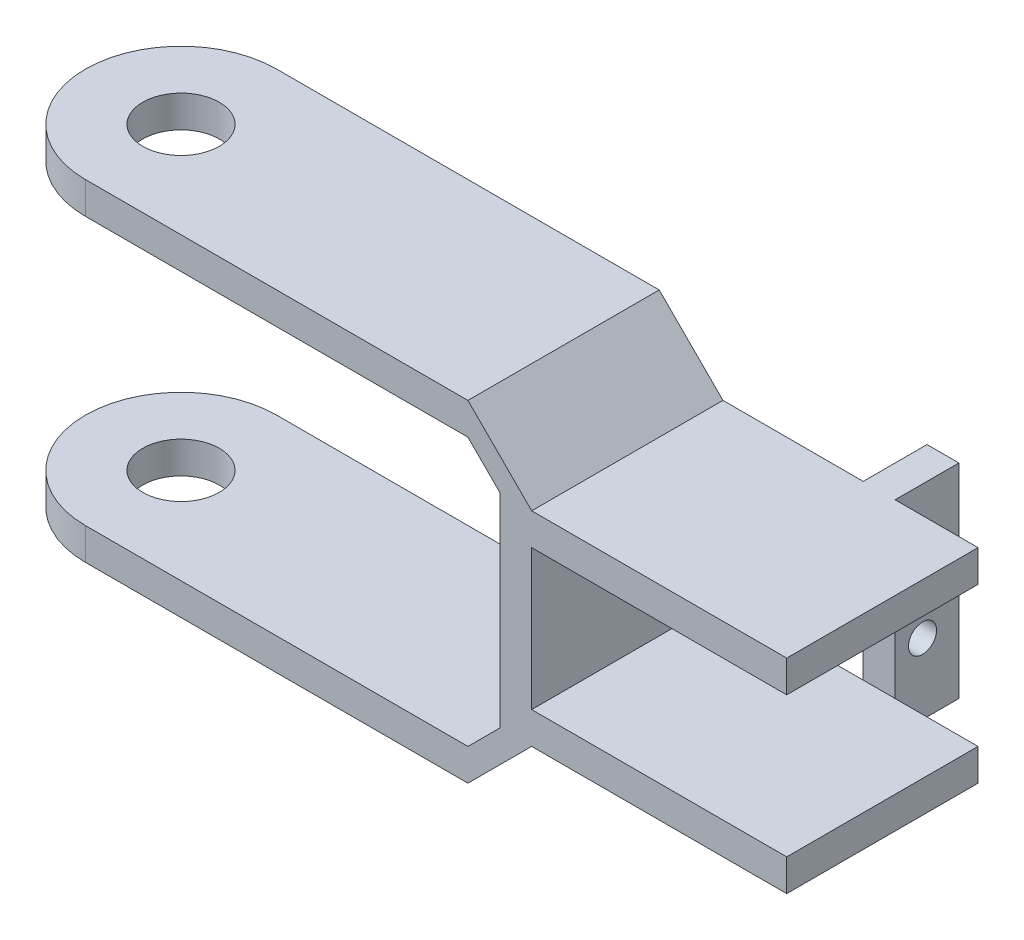
from build123d import *

# Parameters (mm, degrees)
SKETCH1_R           = 6
BOSS_EXTRUDE4_DEPTH = 5
BOSS_EXTRUDE5_DEPTH = 30
BOSS_EXTRUDE6_DEPTH = 30
SKETCH11_R          = 6
BOSS_EXTRUDE7_DEPTH = 5
BOSS_EXTRUDE8_DEPTH = 30
BOSS_EXTRUDE9_DEPTH = 10
CUT_EXTRUDE2_REACH  = 126.008
SKETCH14_R          = 2.2


with BuildPart() as part:
    # Sketch1 → Boss-Extrude4 (new body)
    with BuildSketch(Plane(origin=(0, 0, 0), x_dir=(1, 0, 0), z_dir=(0, 1, 0))):
        with BuildLine():
            Line((0, 15), (60, 15))
            Line((60, 15), (60, -15))
            Line((60, -15), (0, -15))
            ThreePointArc((0, -15), (-15, 0), (0, 15))
        make_face()
        with Locations(Location((0, 0, 0), (0, 0, 270))):
            Circle(SKETCH1_R, mode=Mode.SUBTRACT)
    extrude(amount=BOSS_EXTRUDE4_DEPTH)

    # Sketch8 → Boss-Extrude5 (add)
    with BuildSketch(Plane.XY.offset(15)):
        Polygon((60, 0), (70, -10), (110, -10), (110, -5), (70, -5), (60, 5), align=None)
    extrude(amount=-BOSS_EXTRUDE5_DEPTH)

    # Sketch9 → Boss-Extrude6 (add)
    with BuildSketch(Plane.XY.offset(15)):
        Polygon((70, -10), (70, -21), (65, -21), (65, -5), align=None)
    boss_extrude6 = extrude(amount=-BOSS_EXTRUDE6_DEPTH)

    # Mirror3: Boss-Extrude6 across plane
    add(boss_extrude6.mirror(Plane(origin=(70, -21, -15), x_dir=(0, 0, 1), z_dir=(0, -1, 0))))



with BuildPart() as body_2:
    # Sketch11 → Boss-Extrude7 (new body)
    with BuildSketch(Plane(origin=(0, -42, 0), x_dir=(-1, 0, 0), z_dir=(0, -1, 0))):
        with BuildLine():
            Line((0, 15), (-60, 15))
            Line((-60, 15), (-60, -15))
            Line((-60, -15), (0, -15))
            ThreePointArc((0, -15), (15, 0), (0, 15))
        make_face()
        with Locations(Location((0, 0, 0), (0, 0, 270))):
            Circle(SKETCH11_R, mode=Mode.SUBTRACT)
    extrude(amount=BOSS_EXTRUDE7_DEPTH)


with BuildPart() as part_1:
    add(part.part)

    add(body_2.part)  # Boss-Extrude8 merges body 2
    # Sketch12 → Boss-Extrude8 (add)
    with BuildSketch(Plane(origin=(0, 0, -15), x_dir=(-1, 0, 0), z_dir=(0, 0, -1))):
        Polygon((-70, -32), (-65, -37), (-60, -42), (-60, -47), (-70, -37), (-110, -37), (-110, -32), align=None)
    extrude(amount=-BOSS_EXTRUDE8_DEPTH)

    # Sketch13 → Boss-Extrude9 (add)
    with BuildSketch(Plane(origin=(0, 0, -15), x_dir=(-1, 0, 0), z_dir=(0, 0, -1))):
        Polygon((-97, -10), (-97, -37), (-92, -37), (-92, -5), (-97, -5), align=None)
    extrude(amount=BOSS_EXTRUDE9_DEPTH)

    # Sketch14 → Cut-Extrude2 (cut, up to next)
    with BuildSketch(Plane(origin=(97, 0, 0), x_dir=(0, 0, -1), z_dir=(1, 0, 0)), mode=Mode.PRIVATE) as cut_extrude2_sk1:
        with Locations((19.3, -16.05)):
            Circle(SKETCH14_R)
    cut_extrude2_tool1 = extrude(cut_extrude2_sk1.sketch, amount=-CUT_EXTRUDE2_REACH, mode=Mode.PRIVATE) & part_1.part
    # Sketch14 → Cut-Extrude2 (cut, up to next)
    with BuildSketch(Plane(origin=(97, 0, 0), x_dir=(0, 0, -1), z_dir=(1, 0, 0)), mode=Mode.PRIVATE) as cut_extrude2_sk2:
        with Locations((19.3, -25.95)):
            Circle(SKETCH14_R)
    cut_extrude2_tool2 = extrude(cut_extrude2_sk2.sketch, amount=-CUT_EXTRUDE2_REACH, mode=Mode.PRIVATE) & part_1.part
    add(cut_extrude2_tool1.solids().sort_by_distance((97, -16.05, -19.3))[0], mode=Mode.SUBTRACT)
    add(cut_extrude2_tool2.solids().sort_by_distance((97, -25.95, -19.3))[0], mode=Mode.SUBTRACT)


solid = part_1.part
